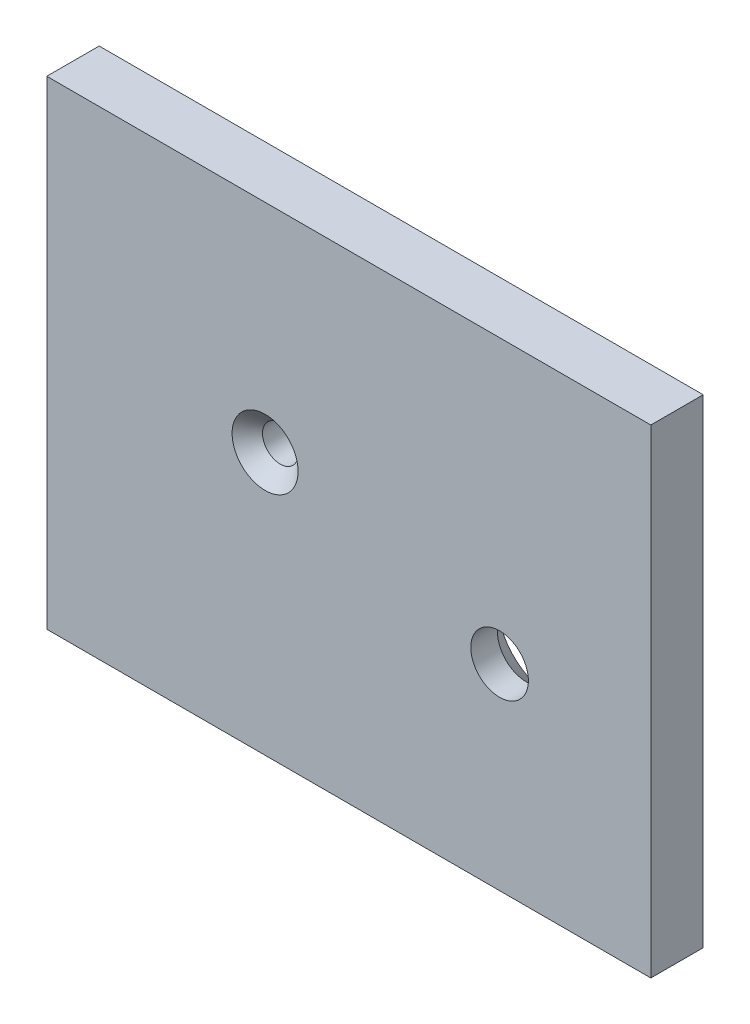
from build123d import *

# Parameters (mm, degrees)
SKETCH1_W                                           = 57.650718963
SKETCH1_H                                           = 45.709483456
BOSS_EXTRUDE1_DEPTH                                 = 5
CSK_FOR_M3_COUNTERSUNK_FLAT_HEAD_SCREW2_D           = 3.4
CSK_FOR_M3_COUNTERSUNK_FLAT_HEAD_SCREW2_CSINK_D     = 6.3
CSK_FOR_M3_COUNTERSUNK_FLAT_HEAD_SCREW2_CSINK_ANGLE = 90


with BuildPart() as part:
    # Sketch1 → Boss-Extrude1 (new body)
    with BuildSketch(Plane.XY):
        with Locations((-28.825359482, -22.854741728)):
            Rectangle(SKETCH1_W, SKETCH1_H)
    extrude(amount=BOSS_EXTRUDE1_DEPTH)

    # CSK for M3 Countersunk Flat Head Screw2 (through all)
    with Locations(Plane.XY.offset(5)):
        with Locations((-36.815052067, -20.667361914)):
            CounterSinkHole(CSK_FOR_M3_COUNTERSUNK_FLAT_HEAD_SCREW2_D / 2, CSK_FOR_M3_COUNTERSUNK_FLAT_HEAD_SCREW2_CSINK_D / 2, counter_sink_angle=CSK_FOR_M3_COUNTERSUNK_FLAT_HEAD_SCREW2_CSINK_ANGLE)

    # Sketch13 → CSK for M5 Countersunk Flat Head Screw1 (revolve, cut)
    with BuildSketch(Plane(origin=(-14.434702808, -26.976225799, 0), x_dir=(0, 1, 0), z_dir=(1, 0, 0))):
        Polygon((0, 0), (0, 5), (2.75, 5), (2.75, 2.45), (5.2, 0), align=None)
    revolve(axis=Axis((-14.434702808, -26.976225799, -6.35), (0, 0, 1)), mode=Mode.SUBTRACT)


solid = part.part
